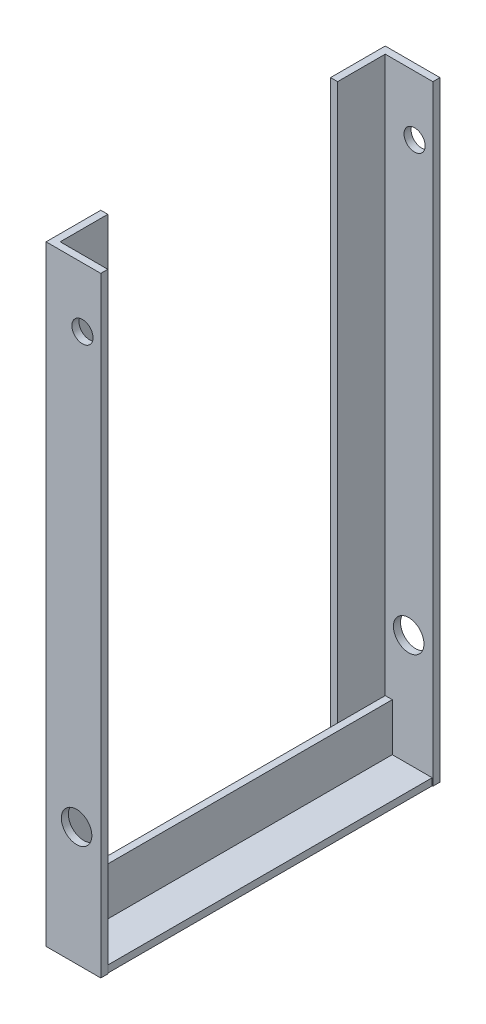
from build123d import *

# Parameters (mm, degrees)
SKETCH1_W               = 3
SKETCH1_H               = 260
BOSS_EXTRUDE1_DEPTH     = 3
SKETCH2_W               = 3
SKETCH2_H               = 260
BOSS_EXTRUDE2_DEPTH     = 20.3
CUT_EXTRUDE1_DEPTH      = 22.3
CUT_EXTRUDE1_DEPTH_BACK = 20.3
SKETCH3_R               = 4.5
SKETCH5_W               = 23.3
SKETCH5_H               = 260
BOSS_EXTRUDE3_DEPTH     = 3
SKETCH6_W               = 3
SKETCH6_H               = 260
BOSS_EXTRUDE4_DEPTH     = 23.3
SKETCH8_W               = 3
SKETCH8_H               = 260
BOSS_EXTRUDE5_DEPTH     = 20.3
SKETCH11_W              = 144.5
SKETCH11_H              = 23.3
BOSS_EXTRUDE6_DEPTH     = 3
SKETCH12_W              = 138.5
SKETCH12_H              = 3
BOSS_EXTRUDE7_DEPTH     = 17
SKETCH10_R              = 6.5
CUT_EXTRUDE3_DEPTH      = 156
CUT_EXTRUDE4_START      = -10
SKETCH7_R               = 4.5
CUT_EXTRUDE4_DEPTH      = 10


with BuildPart() as part:
    # Sketch1 → Boss-Extrude1 (new body)
    with BuildSketch(Plane(origin=(0, 0, 0), x_dir=(0, 0, -1), z_dir=(1, 0, 0))):
        Rectangle(SKETCH1_W, SKETCH1_H)
    extrude(amount=BOSS_EXTRUDE1_DEPTH)

    # Sketch2 → Boss-Extrude2 (add)
    with BuildSketch(Plane(origin=(3, 0, 0), x_dir=(0, 0, -1), z_dir=(1, 0, 0))):
        Rectangle(SKETCH2_W, SKETCH2_H)
    extrude(amount=BOSS_EXTRUDE2_DEPTH)

    # Sketch3 → Cut-Extrude1 (cut, two sides: drawn at the far end of the back side and taken through both)
    with BuildSketch(Plane.XY.offset(1.5).offset(-CUT_EXTRUDE1_DEPTH_BACK)):
        with Locations(Location((15.5, 104.6, 0), (0, 0, 90))):
            Circle(SKETCH3_R)
    extrude(amount=CUT_EXTRUDE1_DEPTH + CUT_EXTRUDE1_DEPTH_BACK, mode=Mode.SUBTRACT)

    # Sketch8 → Boss-Extrude5 (add)
    with BuildSketch(Plane.XY.offset(1.5)):
        with Locations((1.5, 0)):
            Rectangle(SKETCH8_W, SKETCH8_H)
    extrude(amount=BOSS_EXTRUDE5_DEPTH)



with BuildPart() as body_2:
    # Sketch5 → Boss-Extrude3 (new body)
    with BuildSketch(Plane.XY.offset(140)):
        with Locations((11.65, 0)):
            Rectangle(SKETCH5_W, SKETCH5_H)
    extrude(amount=BOSS_EXTRUDE3_DEPTH)

    # Sketch6 → Boss-Extrude4 (add)
    with BuildSketch(Plane.XY.offset(143)):
        with Locations((1.5, 0)):
            Rectangle(SKETCH6_W, SKETCH6_H)
    extrude(amount=-BOSS_EXTRUDE4_DEPTH)


with BuildPart() as part_1:
    add(part.part)

    add(body_2.part)  # Boss-Extrude6 merges body 2
    # Sketch11 → Boss-Extrude6 (add)
    with BuildSketch(Plane(origin=(3, 0, 0), x_dir=(0, 0, -1), z_dir=(1, 0, 0))):
        with Locations((-70.75, -118.35)):
            Rectangle(SKETCH11_W, SKETCH11_H)
    extrude(amount=BOSS_EXTRUDE6_DEPTH)

    # Sketch12 → Boss-Extrude7 (add)
    with BuildSketch(Plane(origin=(6, 0, 0), x_dir=(0, 0, -1), z_dir=(1, 0, 0))):
        with Locations((-70.75, -128.5)):
            Rectangle(SKETCH12_W, SKETCH12_H)
    extrude(amount=BOSS_EXTRUDE7_DEPTH)

    # Sketch10 → Cut-Extrude3 (cut)
    with BuildSketch(Plane(origin=(0, 0, -1.5), x_dir=(-1, 0, 0), z_dir=(0, 0, -1))):
        with Locations(Location((-13, -79.4, 0), (0, 0, 90))):
            Circle(SKETCH10_R)
    extrude(amount=-CUT_EXTRUDE3_DEPTH, mode=Mode.SUBTRACT)

    # Sketch7 → Cut-Extrude4 (cut)
    with BuildSketch(Plane(origin=(0, 0, 140), x_dir=(-1, 0, 0), z_dir=(0, 0, -1)).offset(CUT_EXTRUDE4_START)):
        with Locations(Location((-15.5, 104.6, 0), (0, 0, 90))):
            Circle(SKETCH7_R)
    extrude(amount=CUT_EXTRUDE4_DEPTH, mode=Mode.SUBTRACT)


solid = part_1.part
